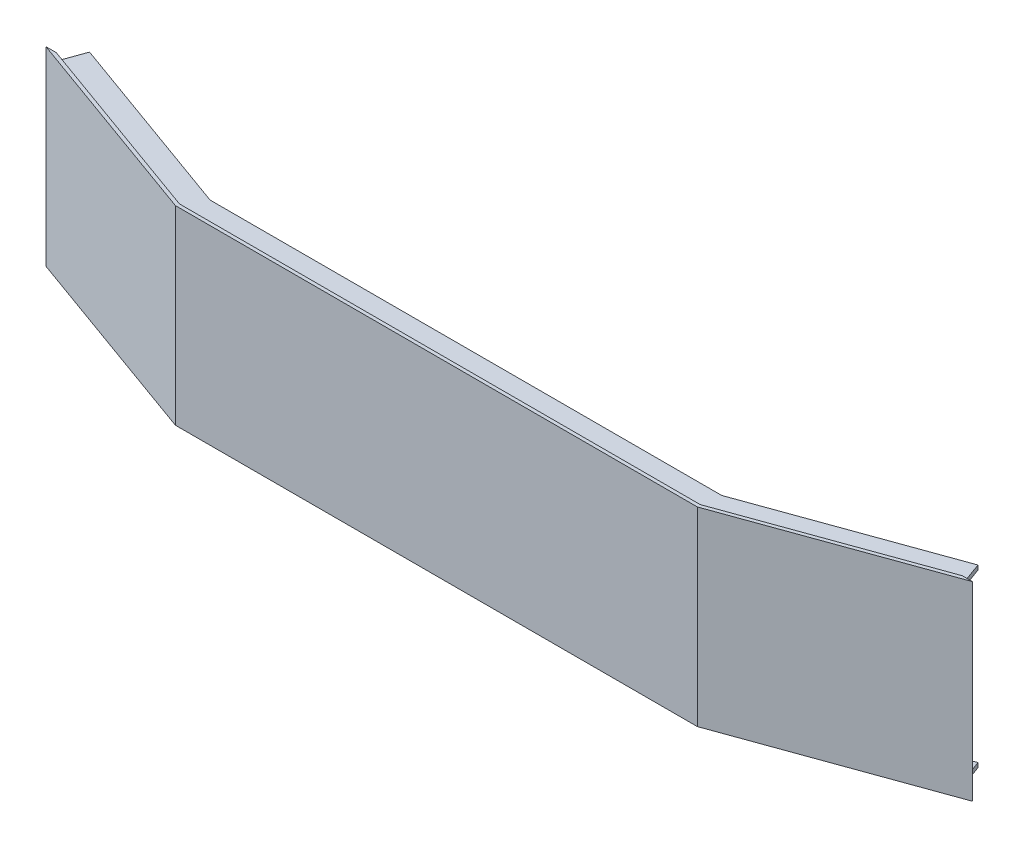
from build123d import *

# Parameters (mm, degrees)
BOSS_EXTRUDE1_DEPTH = 109.600000002
BOSS_EXTRUDE2_DEPTH = 2.54
BOSS_EXTRUDE3_DEPTH = 2.54
RIB2_REACH          = 442.308
SKETCH5_WALL_W      = 932.98348183
SKETCH5_WALL_H      = 2.54
RIB3_REACH          = 442.308
SKETCH6_WALL_W      = 932.983481822
SKETCH6_WALL_H      = 2.54
RIB4_REACH          = 442.308
SKETCH7_WALL_W      = 932.98348183
SKETCH7_WALL_H      = 2.54
RIB5_REACH          = 442.308
SKETCH8_WALL_W      = 932.983481822
SKETCH8_WALL_H      = 2.54
RIB6_REACH          = 332.895
SKETCH13_WALL_W     = 714.088496324
SKETCH13_WALL_H     = 2.54
RIB7_REACH          = 332.895
SKETCH14_WALL_W     = 714.088496324
SKETCH14_WALL_H     = 2.54


with BuildPart() as part:
    # Sketch1 → Boss-Extrude1 (new body)
    with BuildSketch(Plane(origin=(0, 0, 0), x_dir=(1, 0, 0), z_dir=(0, 1, 0))):
        Polygon((-261, -120), (-150, -160), (150, -160), (261, -120), (266.899364373, -120), (150.349364373, -162), (-150.349364373, -162), (-266.899364373, -120), align=None)
    extrude(amount=BOSS_EXTRUDE1_DEPTH)

    # Sketch2 → Boss-Extrude2 (add)
    with BuildSketch(Plane(origin=(0, 4.249999882, 0), x_dir=(1, 0, 0), z_dir=(0, 1, 0))):
        Polygon((147.379767211, -145.000000028), (255.91470639, -105.888310234), (261, -120), (150, -160), (-150, -160), (-261, -120), (-255.91470639, -105.888310234), (-147.379767211, -145.000000028), align=None)
    extrude(amount=BOSS_EXTRUDE2_DEPTH)

    # Sketch4 → Boss-Extrude3 (add)
    with BuildSketch(Plane(origin=(0, 105.35000012, 0), x_dir=(1, 0, 0), z_dir=(0, 1, 0))):
        Polygon((-255.914706381, -105.888310207), (-147.379767206, -145), (147.379767206, -145), (255.914706381, -105.888310207), (261, -120), (150, -160), (-150, -160), (-261, -120), align=None)
    extrude(amount=-BOSS_EXTRUDE3_DEPTH)

    # Sketch5 wall → Rib2 (add, up to next)
    with BuildSketch(Plane(origin=(-148.689883603, 78.80500006, 152.5), x_dir=(-0.052022900314, -0.953205171679, 0.297814570709), z_dir=(0.164024260653, -0.302324164902, -0.938986763077)), mode=Mode.PRIVATE) as rib2_sk1:
        Rectangle(SKETCH5_WALL_W, SKETCH5_WALL_H)
    rib2_tool1 = extrude(rib2_sk1.sketch, amount=-RIB2_REACH, mode=Mode.PRIVATE) - part.part
    add(rib2_tool1.solids().sort_by_distance((-148.689883603, 78.80500006, 152.5))[0])

    # Sketch6 wall → Rib3 (add, up to next)
    with BuildSketch(Plane(origin=(-148.689883606, 30.794999942, 152.500000014), x_dir=(0.052022900223, -0.953205171842, -0.297814570204), z_dir=(0.164024260681, 0.302324164389, -0.938986763237)), mode=Mode.PRIVATE) as rib3_sk1:
        Rectangle(SKETCH6_WALL_W, SKETCH6_WALL_H)
    rib3_tool1 = extrude(rib3_sk1.sketch, amount=-RIB3_REACH, mode=Mode.PRIVATE) - part.part
    add(rib3_tool1.solids().sort_by_distance((-148.689883606, 30.794999942, 152.500000014))[0])

    # Sketch7 wall → Rib4 (add, up to next)
    with BuildSketch(Plane(origin=(148.689883603, 78.80500006, 152.5), x_dir=(0.052022900314, -0.953205171679, 0.297814570709), z_dir=(-0.164024260653, -0.302324164902, -0.938986763077)), mode=Mode.PRIVATE) as rib4_sk1:
        Rectangle(SKETCH7_WALL_W, SKETCH7_WALL_H)
    rib4_tool1 = extrude(rib4_sk1.sketch, amount=-RIB4_REACH, mode=Mode.PRIVATE) - part.part
    add(rib4_tool1.solids().sort_by_distance((148.689883603, 78.80500006, 152.5))[0])

    # Sketch8 wall → Rib5 (add, up to next)
    with BuildSketch(Plane(origin=(148.689883606, 30.794999942, 152.500000014), x_dir=(-0.052022900223, -0.953205171842, -0.297814570204), z_dir=(-0.164024260681, 0.302324164389, -0.938986763237)), mode=Mode.PRIVATE) as rib5_sk1:
        Rectangle(SKETCH8_WALL_W, SKETCH8_WALL_H)
    rib5_tool1 = extrude(rib5_sk1.sketch, amount=-RIB5_REACH, mode=Mode.PRIVATE) - part.part
    add(rib5_tool1.solids().sort_by_distance((148.689883606, 30.794999942, 152.500000014))[0])

    # Sketch13 wall → Rib6 (add, up to next)
    with BuildSketch(Plane(origin=(0, 78.80500006, 152.5), x_dir=(0, -0.954497664491, 0.298218390583), z_dir=(0, -0.298218390583, -0.954497664491)), mode=Mode.PRIVATE) as rib6_sk1:
        Rectangle(SKETCH13_WALL_W, SKETCH13_WALL_H)
    rib6_tool1 = extrude(rib6_sk1.sketch, amount=-RIB6_REACH, mode=Mode.PRIVATE) - part.part
    add(rib6_tool1.solids().sort_by_distance((0, 78.80500006, 152.5))[0])

    # Sketch14 wall → Rib7 (add, up to next)
    with BuildSketch(Plane(origin=(0, 30.794999942, 152.5), x_dir=(0, -0.954497664491, -0.298218390583), z_dir=(0, 0.298218390583, -0.954497664491)), mode=Mode.PRIVATE) as rib7_sk1:
        Rectangle(SKETCH14_WALL_W, SKETCH14_WALL_H)
    rib7_tool1 = extrude(rib7_sk1.sketch, amount=-RIB7_REACH, mode=Mode.PRIVATE) - part.part
    add(rib7_tool1.solids().sort_by_distance((0, 30.794999942, 152.5))[0])


solid = part.part
